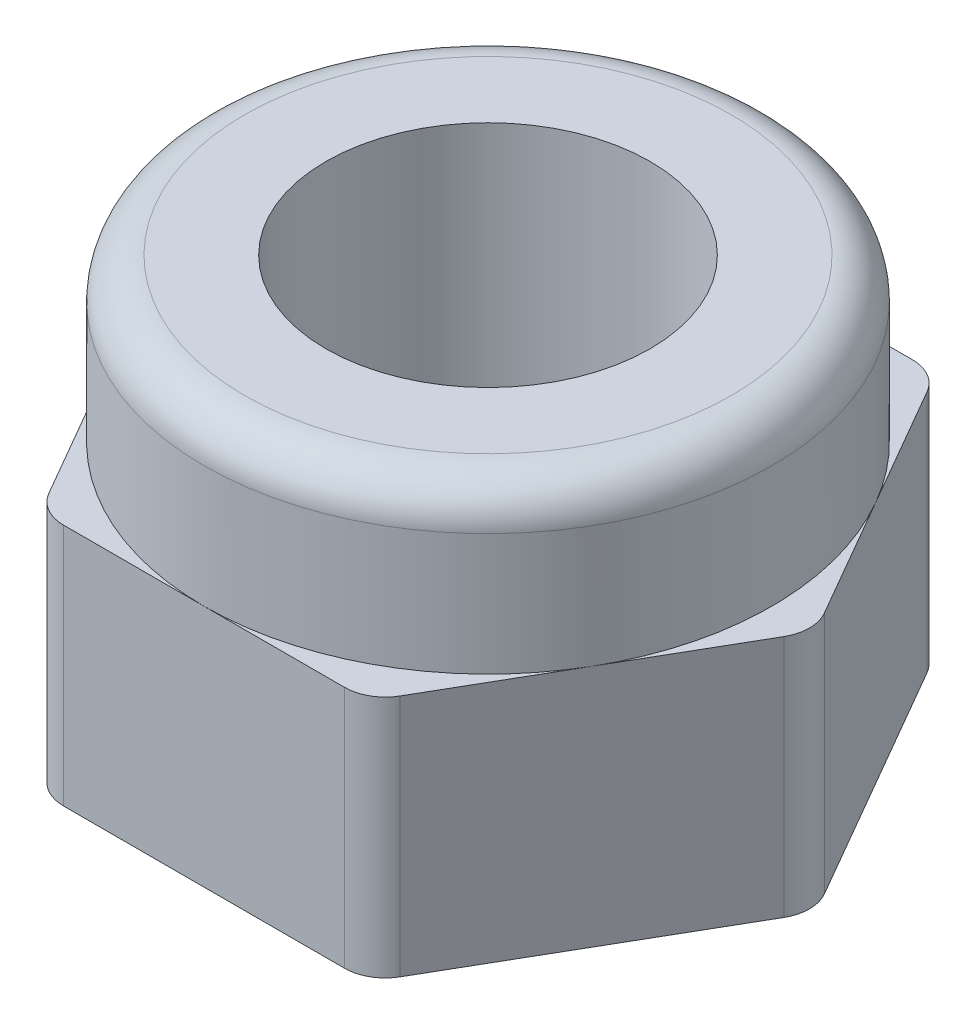
from build123d import *

# Parameters (mm, degrees)
SKETCH2_R           = 2
BOSS_EXTRUDE1_DEPTH = 3
SKETCH6_R           = 3.5
SKETCH6_R_2         = 2
BOSS_EXTRUDE2_DEPTH = 2
FILLET1_R           = 0.5
FILLET4_R           = 0.5


with BuildPart() as part:
    # Sketch2 → Boss-Extrude1 (new body)
    with BuildSketch(Plane(origin=(0, 0, 0), x_dir=(1, 0, 0), z_dir=(0, 1, 0))):
        Polygon((4.041451884, 0), (2.020725942, 3.5), (-2.020725942, 3.5), (-4.041451884, 0), (-2.020725942, -3.5), (2.020725942, -3.5), align=None)
        with Locations(Location((0, 0, 0), (0, 0, 270))):
            Circle(SKETCH2_R, mode=Mode.SUBTRACT)
    extrude(amount=BOSS_EXTRUDE1_DEPTH)

    # Sketch6 → Boss-Extrude2 (add)
    with BuildSketch(Plane(origin=(0, 3, 0), x_dir=(1, 0, 0), z_dir=(0, 1, 0))):
        with Locations(Location((0, 0, 0), (0, 0, 270))):
            Circle(SKETCH6_R)
        with Locations(Location((0, 0, 0), (0, 0, 270))):
            Circle(SKETCH6_R_2, mode=Mode.SUBTRACT)
    extrude(amount=BOSS_EXTRUDE2_DEPTH)

    # Fillet1
    fillet1_edges = [part.edges().sort_by_distance(p)[0] for p in [
        (0, 5, -3.5),
    ]]
    fillet(fillet1_edges, radius=FILLET1_R)

    # Fillet4
    fillet4_edges = [part.edges().sort_by_distance(p)[0] for p in [
        (2.020725942, 1.5, 3.5),
        (-2.020725942, 1.5, 3.5),
        (-4.041451884, 1.5, 0),
        (-2.020725942, 1.5, -3.5),
        (2.020725942, 1.5, -3.5),
        (4.041451884, 1.5, 0),
    ]]
    fillet(fillet4_edges, radius=FILLET4_R)


solid = part.part
